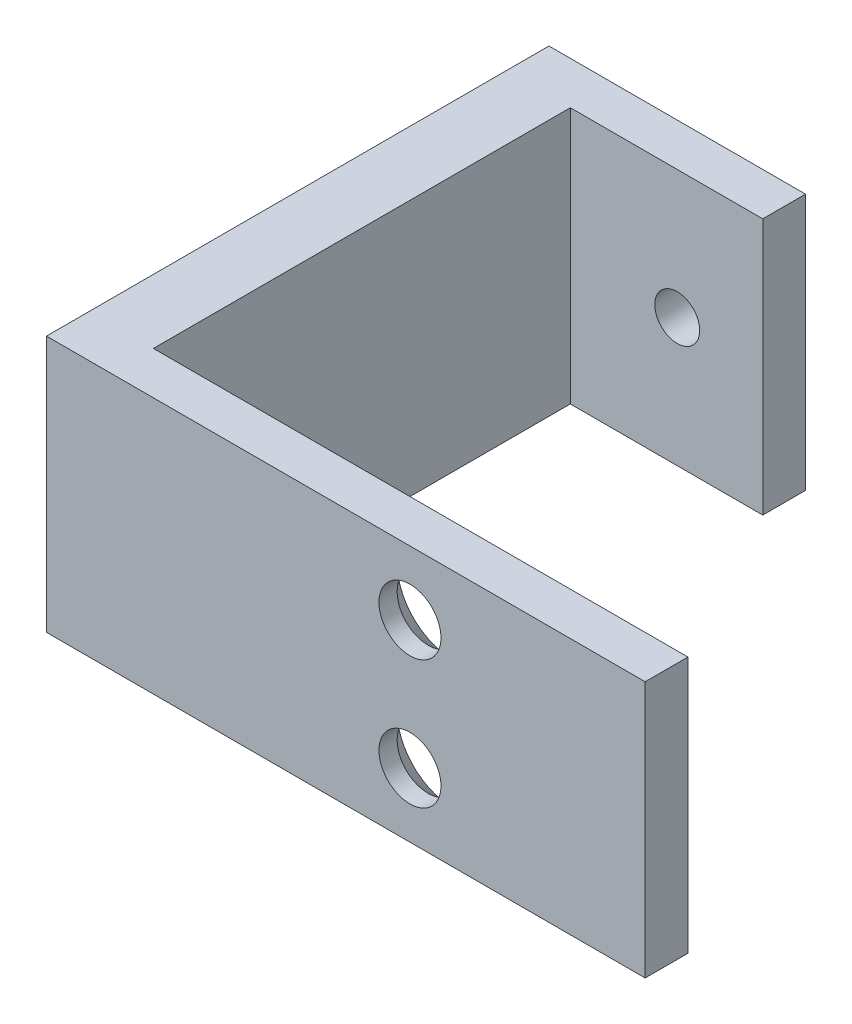
from build123d import *

# Parameters (mm, degrees)
LINK_EYE_SHELF_START          = -23.5
SKETCH1_W                     = 12
SKETCH1_H                     = 12
SKETCH1_R                     = 1.05
LINK_EYE_SHELF_DEPTH          = 2
OUTBOARD_WEB_START            = -22.5
SKETCH2_W                     = 3
SKETCH2_H                     = 12
OUTBOARD_WEB_DEPTH            = 21.5
CARRIAGE_PLATE_FOOT_START     = -2
SKETCH3_W                     = 28
SKETCH3_H                     = 12
CARRIAGE_PLATE_FOOT_DEPTH     = 2
SKETCH6_R                     = 1.45
YTAB_D2P9_DEPTH               = 2.01
SKETCH7_R                     = 2.6
YTAB_CSK_D5P2_DEPTH           = 1.15
YTAB_CSK_D5P2_DRAFT           = -45
YTAB_CSK_D5P2_PROFILE_2_DEPTH = 1.15
YTAB_CSK_D5P2_PROFILE_2_DRAFT = -45


with BuildPart() as part:
    # Sketch1 → Link_Eye_Shelf (new body)
    with BuildSketch(Plane.XY.offset(LINK_EYE_SHELF_START)):
        with Locations((-38, -20)):
            Rectangle(SKETCH1_W, SKETCH1_H)
        with Locations((-36, -20)):
            Circle(SKETCH1_R, mode=Mode.SUBTRACT)
    extrude(amount=LINK_EYE_SHELF_DEPTH)

    # Sketch2 → Outboard_Web (add)
    with BuildSketch(Plane.XY.offset(OUTBOARD_WEB_START)):
        with Locations((-42.5, -20)):
            Rectangle(SKETCH2_W, SKETCH2_H)
    extrude(amount=OUTBOARD_WEB_DEPTH)

    # Sketch3 → Carriage_Plate_Foot (add)
    with BuildSketch(Plane.XY.offset(CARRIAGE_PLATE_FOOT_START)):
        with Locations((-30, -20)):
            Rectangle(SKETCH3_W, SKETCH3_H)
    extrude(amount=CARRIAGE_PLATE_FOOT_DEPTH)

    # Sketch6 → YTab_D2p9 (cut)
    with BuildSketch(Plane(origin=(0, 0, -2), x_dir=(-1, 0, 0), z_dir=(0, 0, -1))):
        with Locations((27, -23)):
            Circle(SKETCH6_R)
        with Locations((27, -17)):
            Circle(SKETCH6_R)
    extrude(amount=-YTAB_D2P9_DEPTH, mode=Mode.SUBTRACT)


with BuildPart() as ytab_csk_d5p2_tool:
    # Sketch7 → YTab_CSK_D5p2 (with draft: the straight prism first)
    with BuildSketch(Plane(origin=(0, 0, -2), x_dir=(-1, 0, 0), z_dir=(0, 0, -1))):
        with Locations((27, -23)):
            Circle(SKETCH7_R)
    extrude(amount=-YTAB_CSK_D5P2_DEPTH)
    # YTab_CSK_D5p2: the draft: its side faces are tilted about the plane it starts from
    ytab_csk_d5p2_sides = [ytab_csk_d5p2_tool.faces().sort_by_distance(p)[0] for p in [
        (-24.4, -23, -1.425),
    ]]
    draft(ytab_csk_d5p2_sides, Plane(origin=(0, 0, -2), x_dir=(-1, 0, 0), z_dir=(0, 0, -1)), YTAB_CSK_D5P2_DRAFT)


with BuildPart() as part_1:
    add(part.part)

    # YTab_CSK_D5p2: cut by ytab_csk_d5p2_tool
    add(ytab_csk_d5p2_tool.part, mode=Mode.SUBTRACT)


with BuildPart() as ytab_csk_d5p2_profile_2_tool:
    # Sketch7 → YTab_CSK_D5p2 profile 2 (with draft: the straight prism first)
    with BuildSketch(Plane(origin=(0, 0, -2), x_dir=(-1, 0, 0), z_dir=(0, 0, -1))):
        with Locations((27, -17)):
            Circle(SKETCH7_R)
    extrude(amount=-YTAB_CSK_D5P2_PROFILE_2_DEPTH)
    # YTab_CSK_D5p2 profile 2: the draft: its side faces are tilted about the plane it starts from
    ytab_csk_d5p2_profile_2_sides = [ytab_csk_d5p2_profile_2_tool.faces().sort_by_distance(p)[0] for p in [
        (-24.4, -17, -1.425),
    ]]
    draft(ytab_csk_d5p2_profile_2_sides, Plane(origin=(0, 0, -2), x_dir=(-1, 0, 0), z_dir=(0, 0, -1)), YTAB_CSK_D5P2_PROFILE_2_DRAFT)


with BuildPart() as part_2:
    add(part_1.part)

    # YTab_CSK_D5p2 profile 2: cut by ytab_csk_d5p2_profile_2_tool
    add(ytab_csk_d5p2_profile_2_tool.part, mode=Mode.SUBTRACT)


solid = part_2.part
